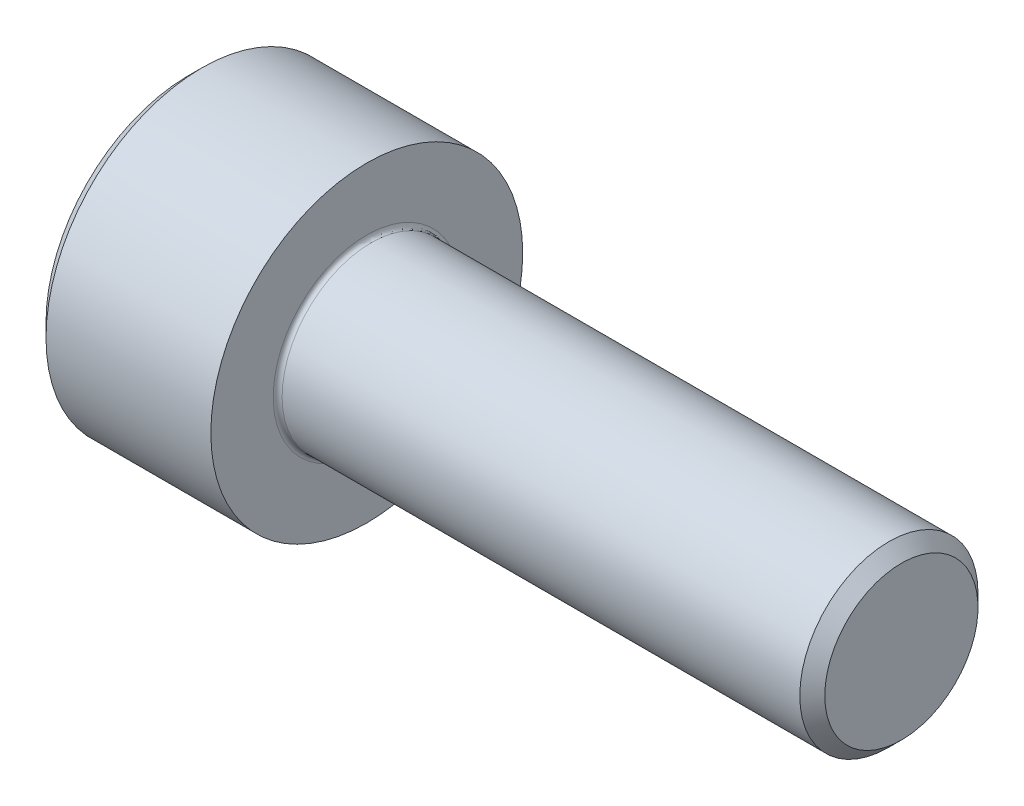
from build123d import *

# Parameters (mm, degrees)
FILLET1_R     = 0.1
HEX_2_DEPTH   = 1.3
CHAMFER1_SIZE = 0.3


with BuildPart() as part:
    # BodySke → Base-Revolve (revolve)
    with BuildSketch(Plane.XY, mode=Mode.PRIVATE) as base_revolve_sk:
        Polygon((0, 0), (0, 3.5), (4, 3.5), (4, 2), (15.7195, 2), (16, 1.7195), (16, 0), align=None)
    revolve(base_revolve_sk.sketch.rotate(Axis((-31.75, 0, 0), (1, 0, 0)), 90), axis=Axis((-31.75, 0, 0), (1, 0, 0)))

    # Fillet1
    fillet1_edges = [part.edges().sort_by_distance(p)[0] for p in [
        (4, 0, -2),
    ]]
    fillet(fillet1_edges, radius=FILLET1_R)

    # Sketch2 → Hex-PreBroach (revolve, cut)
    with BuildSketch(Plane.XY, mode=Mode.PRIVATE) as hex_prebroach_sk:
        Polygon((0, 1.5), (1.3, 1.5), (2.166025404, 0), (0, 0), align=None)
    revolve(hex_prebroach_sk.sketch.rotate(Axis((0, 0, 0), (1, 0, 0)), 90), axis=Axis((0, 0, 0), (1, 0, 0)), mode=Mode.SUBTRACT)

    # Sketch3 → Hex 2 (cut)
    with BuildSketch(Plane(origin=(0, 0, 0), x_dir=(0, 0.500000000000001, 0.866025403784438), z_dir=(-1, 0, 0))):
        Polygon((0.866025404, 1.5), (-0.866025404, 1.5), (-1.732050808, 0), (-0.866025404, -1.5), (0.866025404, -1.5), (1.732050808, 0), align=None)
    extrude(amount=-HEX_2_DEPTH, mode=Mode.SUBTRACT)

    # Chamfer1
    chamfer1_edges = [part.edges().sort_by_distance(p)[0] for p in [
        (0, 0, -3.5),
    ]]
    chamfer(chamfer1_edges, length=CHAMFER1_SIZE)

    # Sketch4 → Cut-Revolve1 (revolve, cut)
    with BuildSketch(Plane(origin=(0, 0, 0), x_dir=(1, 0, 0), z_dir=(0, 1, 0))):
        Polygon((0, 1.778), (1.026528779, 0), (0, 0), align=None)
    revolve(axis=Axis((1.026528779, 0, 0), (1, 0, 0)), mode=Mode.SUBTRACT)


solid = part.part
